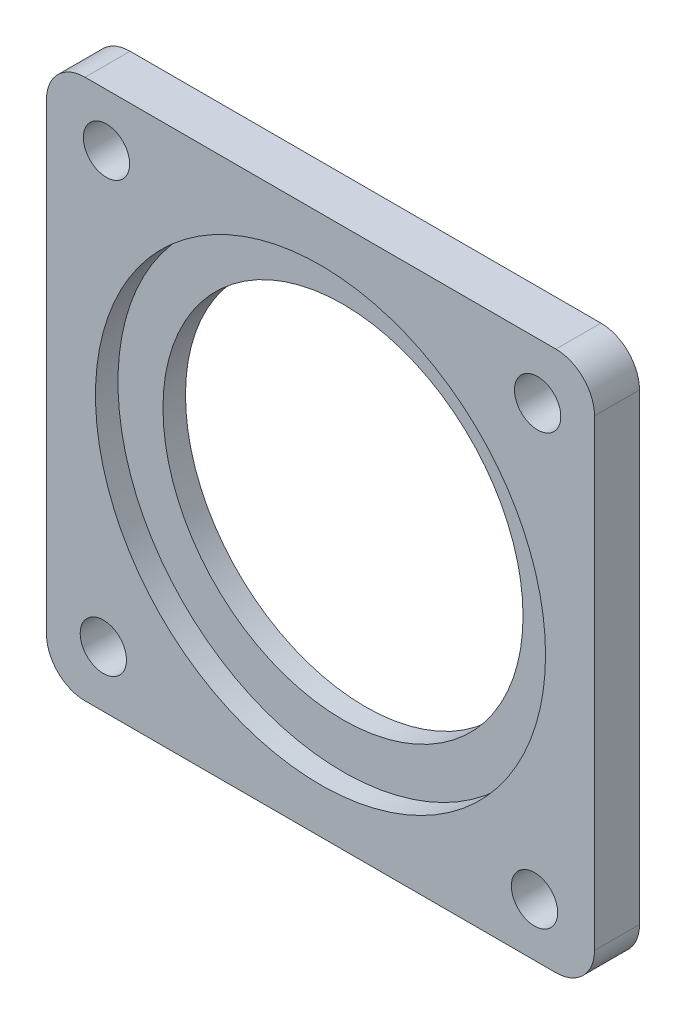
from build123d import *

# Parameters (mm, degrees)
SKETCH1_W            = 42.614634146
SKETCH1_H            = 42
SKETCH1_R            = 14
BOSS_EXTRUDE1_DEPTH  = 3.5
SKETCH2_R            = 17.5
CUT_EXTRUDE1_DEPTH   = 1.75
M3_CLEARANCE_HOLE1_D = 3.6
FILLET1_R            = 3


with BuildPart() as part:
    # Sketch1 → Boss-Extrude1 (new body)
    with BuildSketch(Plane.XY):
        Rectangle(SKETCH1_W, SKETCH1_H)
        Circle(SKETCH1_R, mode=Mode.SUBTRACT)
    extrude(amount=BOSS_EXTRUDE1_DEPTH)

    # Sketch2 → Cut-Extrude1 (cut)
    with BuildSketch(Plane.XY.offset(3.5)):
        Circle(SKETCH2_R)
    extrude(amount=-CUT_EXTRUDE1_DEPTH, mode=Mode.SUBTRACT)

    # M3 Clearance Hole1 (through all)
    with Locations(Plane(origin=(0, 0, 0), x_dir=(-1, 0, 0), z_dir=(0, 0, -1))):
        with Locations((-16.642079068, -16.885621688), (-16.885621688, 16.642079068), (16.642079068, 16.885621688), (16.885621688, -16.642079068)):
            Hole(M3_CLEARANCE_HOLE1_D / 2)

    # Fillet1
    fillet1_edges = [part.edges().sort_by_distance(p)[0] for p in [
        (-21.307317073, 21, 1.75),
        (21.307317073, 21, 1.75),
        (21.307317073, -21, 1.75),
        (-21.307317073, -21, 1.75),
    ]]
    fillet(fillet1_edges, radius=FILLET1_R)


solid = part.part
